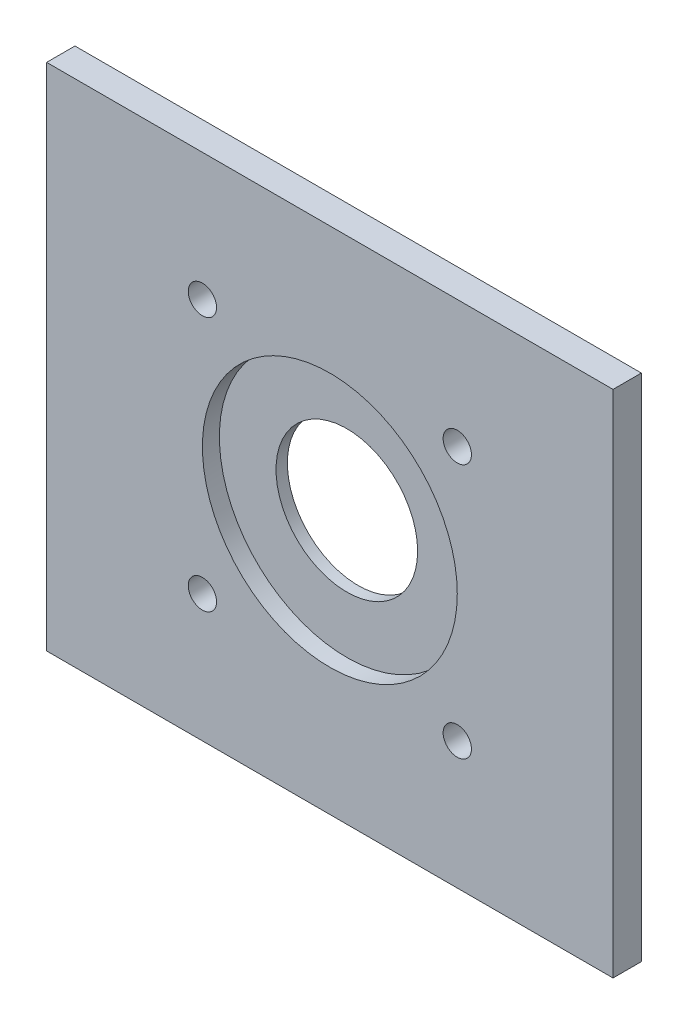
from build123d import *

# Parameters (mm, degrees)
SKETCH1_W           = 100
SKETCH1_H           = 90
SKETCH1_R           = 2.5
SKETCH1_R_2         = 12.5
BOSS_EXTRUDE1_DEPTH = 5
SKETCH3_R           = 22.5
CUT_EXTRUDE2_DEPTH  = 3


with BuildPart() as part:
    # Sketch1 → Boss-Extrude1 (new body)
    with BuildSketch(Plane.XY):
        with Locations((50, 45)):
            Rectangle(SKETCH1_W, SKETCH1_H)
        with Locations((27.5, 67.5)):
            Circle(SKETCH1_R, mode=Mode.SUBTRACT)
        with Locations((72.5, 67.5)):
            Circle(SKETCH1_R, mode=Mode.SUBTRACT)
        with Locations((72.5, 22.5)):
            Circle(SKETCH1_R, mode=Mode.SUBTRACT)
        with Locations((27.5, 22.5)):
            Circle(SKETCH1_R, mode=Mode.SUBTRACT)
        with Locations((50, 45)):
            Circle(SKETCH1_R_2, mode=Mode.SUBTRACT)
    extrude(amount=BOSS_EXTRUDE1_DEPTH)

    # Sketch3 → Cut-Extrude2 (cut)
    with BuildSketch(Plane.XY.offset(5)):
        with Locations((50, 45)):
            Circle(SKETCH3_R)
    extrude(amount=-CUT_EXTRUDE2_DEPTH, mode=Mode.SUBTRACT)


solid = part.part
